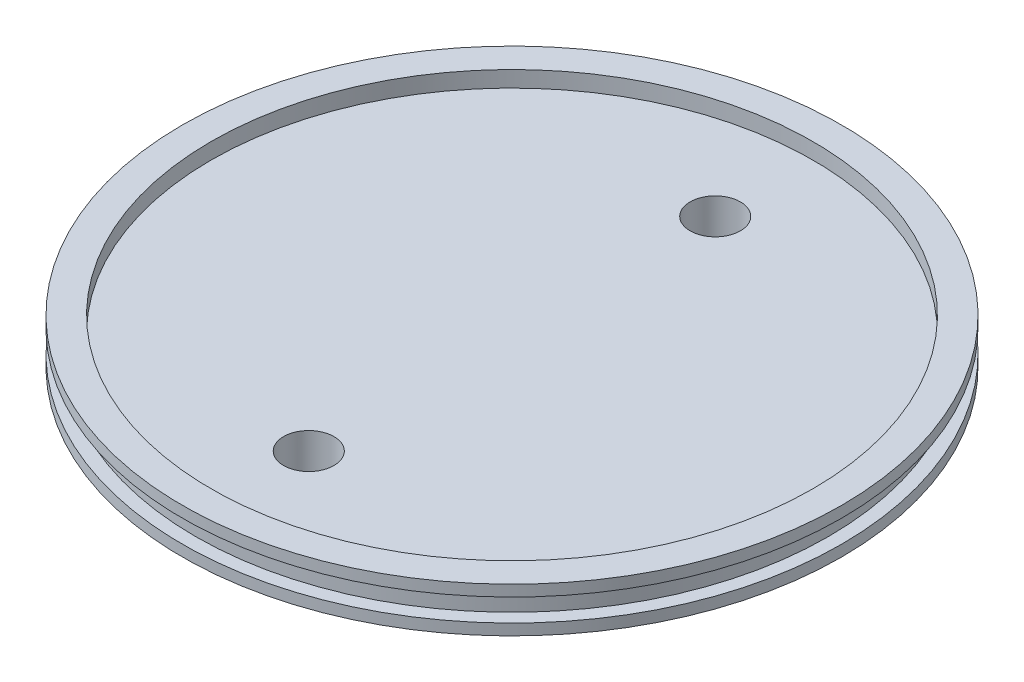
from build123d import *

# Parameters (mm, degrees)
SKETCH6_R                                = 66.04
BOSS_EXTRUDE1_DEPTH                      = 2.54
PIPE_TAP_DRILL_FOR_1_4_TAP_RELIEF_VALV_D = 11.1252
PIPE_TAP_DRILL_FOR_1_4_TAP_VENT_VALVE_D  = 11.1252


with BuildPart() as part:
    # Sketch1 → Revolve1 (revolve)
    with BuildSketch(Plane.XY, mode=Mode.PRIVATE) as revolve1_sk:
        Polygon((0, 0), (72.898, 0), (72.898, 2.4638), (69.977, 2.4638), (69.977, 7.4422), (72.898, 7.4422), (72.898, 9.906), (66.548, 9.906), (66.548, 6.35), (0, 6.35), align=None)
    revolve(revolve1_sk.sketch.rotate(Axis((0, 48.192213231, 0), (0, -1, 0)), 180), axis=Axis((0, 48.192213231, 0), (0, -1, 0)))

    # Sketch6 → Boss-Extrude1 (add)
    with BuildSketch(Plane.XZ):
        Circle(SKETCH6_R)
    extrude(amount=BOSS_EXTRUDE1_DEPTH)

    # Pipe Tap Drill for 1/4 Tap - Relief Valve (through all)
    with Locations(Plane(origin=(0, -2.54, 0), x_dir=(-1, 0, 0), z_dir=(0, -1, 0))):
        with Locations((0, 44.958)):
            Hole(PIPE_TAP_DRILL_FOR_1_4_TAP_RELIEF_VALV_D / 2)

    # Pipe Tap Drill for 1/4 Tap - Vent Valve (through all)
    with Locations(Plane(origin=(0, -2.54, 0), x_dir=(-1, 0, 0), z_dir=(0, -1, 0))):
        with Locations((0, -44.958)):
            Hole(PIPE_TAP_DRILL_FOR_1_4_TAP_VENT_VALVE_D / 2)


solid = part.part
